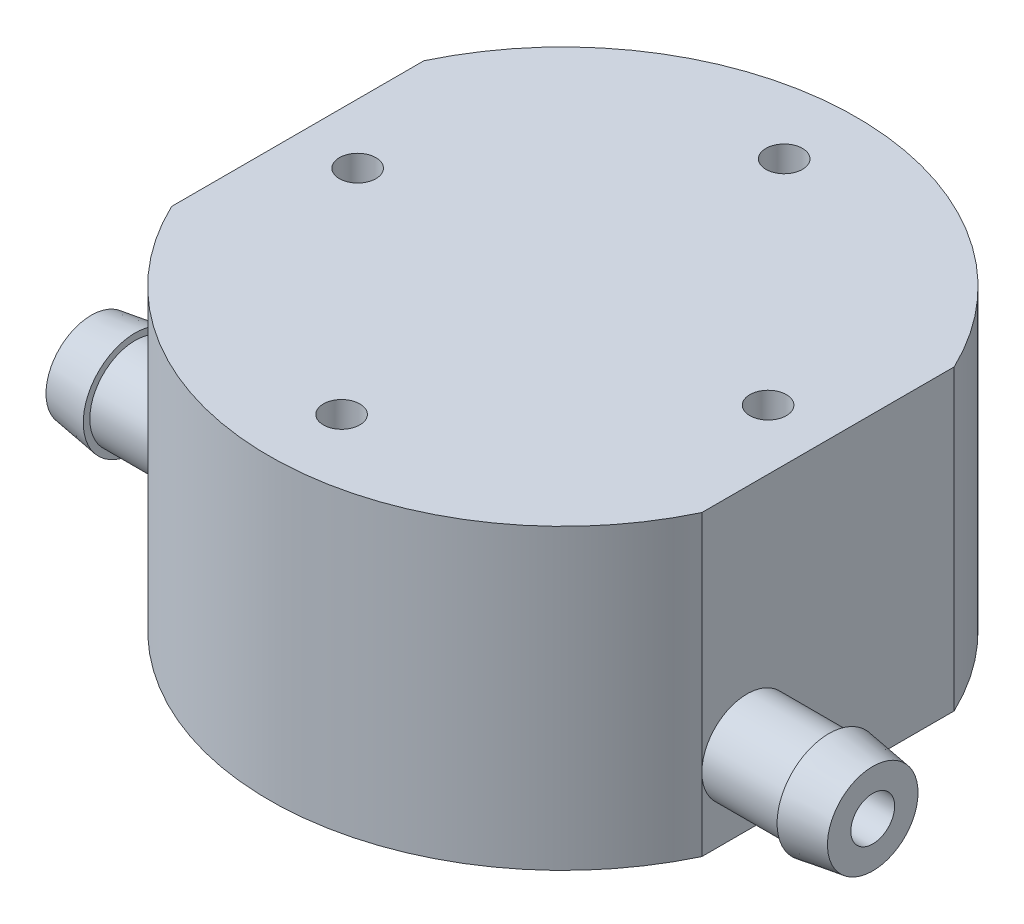
from build123d import *

# Parameters (mm, degrees)
BOSS_EXTRUDE1_DEPTH       = 20.4
M3X0_5_TAPPED_HOLE1_D     = 2.5
M3X0_5_TAPPED_HOLE1_DEPTH = 7.5
M3X0_5_TAPPED_HOLE1_TIP   = 0.751075774
BOSS_EXTRUDE3_DEPTH       = 8.6
BOSS_EXTRUDE3_DEPTH_BACK  = 44.9
SKETCH5_R                 = 3.1
SKETCH8_R                 = 1.5
CUT_EXTRUDE1_DEPTH        = 61.682946534


with BuildPart() as part:
    # Sketch1 → Boss-Extrude1 (new body)
    with BuildSketch(Plane(origin=(0, 0, 0), x_dir=(1, 0, 0), z_dir=(0, 1, 0))):
        with BuildLine():
            Line((-18.15, -8.636405502), (-18.15, 8.636405502))
            ThreePointArc((-18.15, 8.636405502), (0, 20.1), (18.15, 8.636405502))
            Line((18.15, 8.636405502), (18.15, -8.636405502))
            ThreePointArc((18.15, -8.636405502), (0, -20.1), (-18.15, -8.636405502))
        make_face()
    extrude(amount=-BOSS_EXTRUDE1_DEPTH)

    # M3x0.5 Tapped Hole1
    with Locations(Plane(origin=(0, 0, 0), x_dir=(1, 0, 0), z_dir=(0, 1, 0))):
        with Locations((0, 15.15), (0, -15.15), (14.05, 0), (-14.05, 0)):
            Hole(M3X0_5_TAPPED_HOLE1_D / 2, depth=M3X0_5_TAPPED_HOLE1_DEPTH)
            with Locations((0, 0, -(M3X0_5_TAPPED_HOLE1_DEPTH + M3X0_5_TAPPED_HOLE1_TIP / 2))):  # 118° drill point
                Cone(0, M3X0_5_TAPPED_HOLE1_D / 2, M3X0_5_TAPPED_HOLE1_TIP, mode=Mode.SUBTRACT)

    # Sketch5 → Boss-Extrude3 (add, two sides: drawn at the far end of the back side and taken through both)
    with BuildSketch(Plane(origin=(18.15, 0, 0), x_dir=(0, 0, -1), z_dir=(1, 0, 0)).offset(-BOSS_EXTRUDE3_DEPTH_BACK)):
        with Locations(Location((-5.536405502, -15.4, 0), (0, 0, 180))):
            Circle(SKETCH5_R)
    extrude(amount=BOSS_EXTRUDE3_DEPTH + BOSS_EXTRUDE3_DEPTH_BACK)

    # Sketch7 → Revolve1 (revolve)
    with BuildSketch(Plane.XY.offset(5.536405502), mode=Mode.PRIVATE) as revolve1_sk:
        Polygon((26.75, -12.3), (23.75, -11.85), (23.75, -12.3), align=None)
        Polygon((-26.75, -12.3), (-23.75, -11.85), (-23.75, -12.3), align=None)
    revolve(revolve1_sk.sketch.rotate(Axis((26.75, -15.4, 5.536405502), (-1, 0, 0)), 270), axis=Axis((26.75, -15.4, 5.536405502), (-1, 0, 0)))

    # Sketch8 → Cut-Extrude1 (cut, through all)
    with BuildSketch(Plane(origin=(26.75, 0, 0), x_dir=(0, 0, -1), z_dir=(1, 0, 0))):
        with Locations((-5.536405502, -15.4)):
            Circle(SKETCH8_R)
    extrude(amount=-CUT_EXTRUDE1_DEPTH, mode=Mode.SUBTRACT)


solid = part.part
